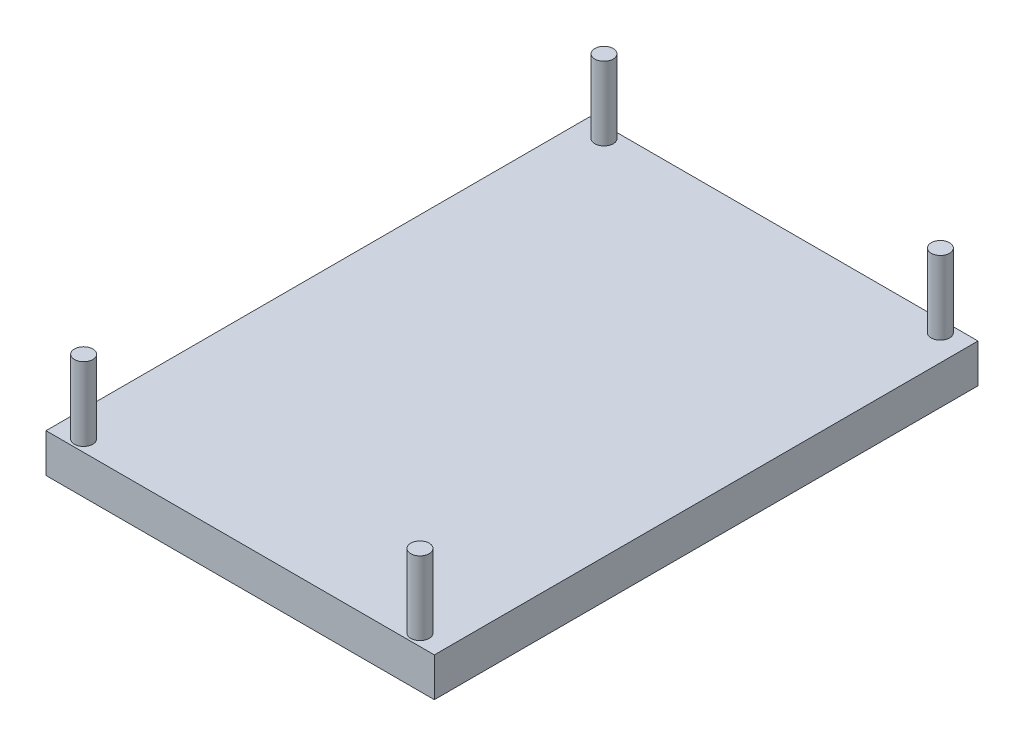
from build123d import *

# Parameters (mm, degrees)
SKETCH1_W           = 63.5
SKETCH1_H           = 88.9
BOSS_EXTRUDE1_DEPTH = 6.35
SKETCH2_R           = 1.5
BOSS_EXTRUDE2_DEPTH = 12


with BuildPart() as part:
    # Sketch1 → Boss-Extrude1 (new body)
    with BuildSketch(Plane(origin=(0, 0, 0), x_dir=(1, 0, 0), z_dir=(0, 1, 0))):
        Rectangle(SKETCH1_W, SKETCH1_H)
    extrude(amount=BOSS_EXTRUDE1_DEPTH)

    # Sketch2 → Boss-Extrude2 (add)
    with BuildSketch(Plane(origin=(0, 6.35, 0), x_dir=(1, 0, 0), z_dir=(0, 1, 0))):
        with Locations(Location((-27.5, 42.547666838, 0), (0, 0, 270))):
            Circle(SKETCH2_R)
        with Locations(Location((27.5, 42.547666838, 0), (0, 0, 270))):
            Circle(SKETCH2_R)
        with Locations(Location((27.5, -42.547666838, 0), (0, 0, 270))):
            Circle(SKETCH2_R)
        with Locations(Location((-27.5, -42.547666838, 0), (0, 0, 270))):
            Circle(SKETCH2_R)
    extrude(amount=BOSS_EXTRUDE2_DEPTH)


solid = part.part
